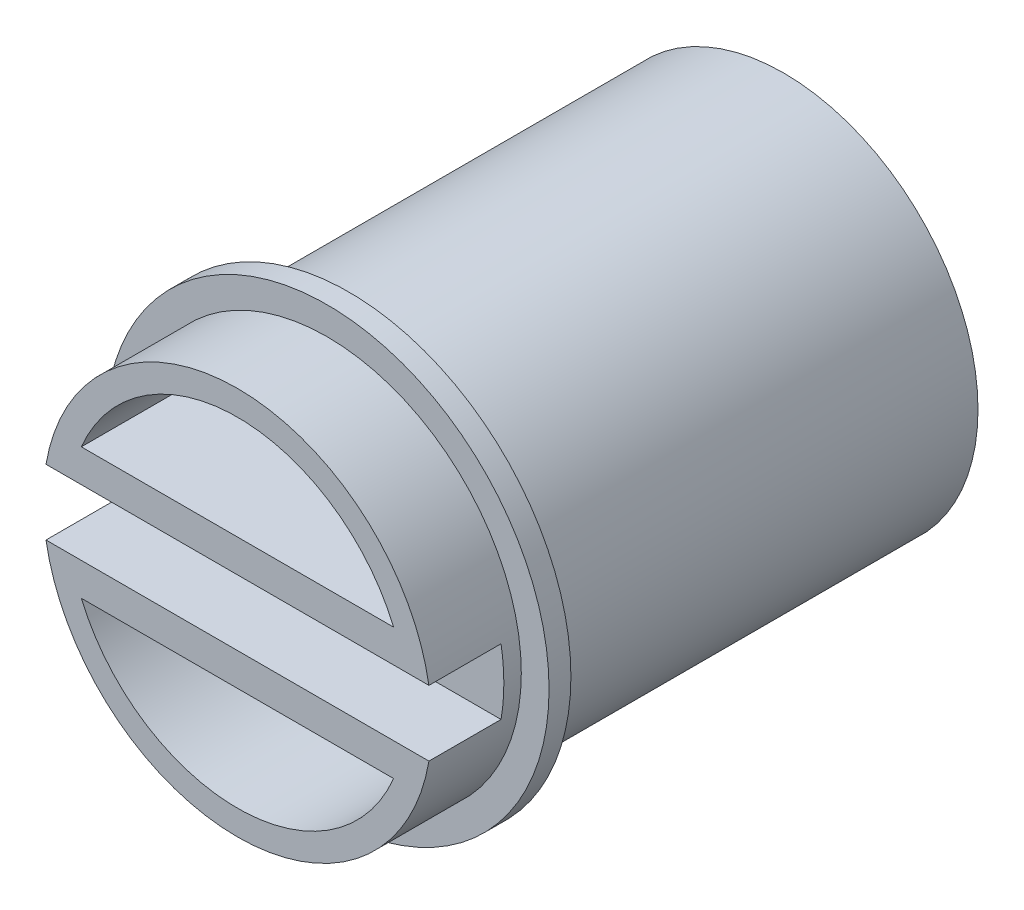
from build123d import *

# Parameters (mm, degrees)
SKETCH1_R           = 101.6
BOSS_EXTRUDE1_DEPTH = 250
CUT_EXTRUDE1_DEPTH  = 33
SKETCH4_R           = 101.6
SKETCH4_R_2         = 88.9
CUT_EXTRUDE2_DEPTH  = 41
CUT_EXTRUDE3_START  = -199
SKETCH5_R           = 101.6
SKETCH5_R_2         = 88.9
CUT_EXTRUDE3_DEPTH  = 199
SKETCH6_W           = 50
SKETCH6_H           = 30
CUT_EXTRUDE4_DEPTH  = 287


with BuildPart() as part:
    # Sketch1 → Boss-Extrude1 (new body)
    with BuildSketch(Plane.XY):
        Circle(SKETCH1_R)
    extrude(amount=-BOSS_EXTRUDE1_DEPTH)

    # Sketch2 → Cut-Extrude1 (cut)
    with BuildSketch(Plane.XY):
        with BuildLine():
            Line((87.625395862, 15), (-87.625395862, 15))
            ThreePointArc((-87.625395862, 15), (-88.9, 0), (-87.625395862, -15))
            Line((-87.625395862, -15), (87.625395862, -15))
            ThreePointArc((87.625395862, -15), (88.580775827, -7.527028227), (88.9, 0))
            ThreePointArc((88.9, 0), (88.580775827, 7.527028227), (87.625395862, 15))
        make_face()
    extrude(amount=-CUT_EXTRUDE1_DEPTH, mode=Mode.SUBTRACT)

    # Sketch4 → Cut-Extrude2 (cut)
    with BuildSketch(Plane.XY):
        Circle(SKETCH4_R)
        Circle(SKETCH4_R_2, mode=Mode.SUBTRACT)
    extrude(amount=-CUT_EXTRUDE2_DEPTH, mode=Mode.SUBTRACT)

    # Sketch5 → Cut-Extrude3 (cut)
    with BuildSketch(Plane(origin=(0, 0, -250), x_dir=(-1, 0, 0), z_dir=(0, 0, -1)).offset(CUT_EXTRUDE3_START)):
        with Locations(Location((0, 0, 0), (0, 0, 180))):
            Circle(SKETCH5_R)
        with Locations(Location((0, 0, 0), (0, 0, 180))):
            Circle(SKETCH5_R_2, mode=Mode.SUBTRACT)
    extrude(amount=CUT_EXTRUDE3_DEPTH, mode=Mode.SUBTRACT)

    # Sketch6 → Cut-Extrude4 (cut)
    with BuildSketch(Plane.XY):
        with BuildLine():
            Line((-71.45802964, 30), (71.45802964, 30))
            ThreePointArc((71.45802964, 30), (0, 77.5), (-71.45802964, 30))
        make_face()
        with BuildLine():
            Line((-71.45802964, -30), (71.45802964, -30))
            ThreePointArc((71.45802964, -30), (0, -77.5), (-71.45802964, -30))
        make_face()
        Rectangle(SKETCH6_W, SKETCH6_H)
    extrude(amount=-CUT_EXTRUDE4_DEPTH, mode=Mode.SUBTRACT)


solid = part.part
